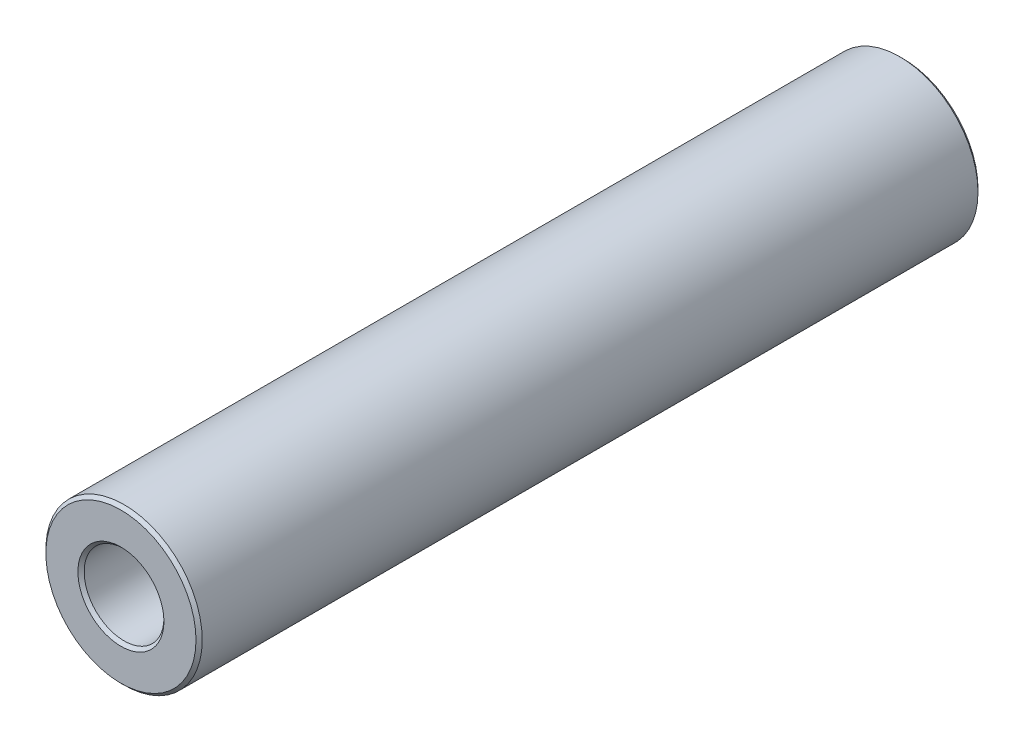
from build123d import *

# Parameters (mm, degrees)
SKETCH1_R           = 5
SKETCH1_R_2         = 2.55
BOSS_EXTRUDE1_DEPTH = 50
CHAMFER1_SIZE       = 0.2


with BuildPart() as part:
    # Sketch1 → Boss-Extrude1 (new body)
    with BuildSketch(Plane.XY):
        Circle(SKETCH1_R)
        Circle(SKETCH1_R_2, mode=Mode.SUBTRACT)
    extrude(amount=BOSS_EXTRUDE1_DEPTH)

    # Chamfer1
    chamfer1_edges = [part.edges().sort_by_distance(p)[0] for p in [
        (-5, 0, 0),
        (-5, 0, 50),
        (-2.55, 0, 0),
        (-2.55, 0, 50),
    ]]
    chamfer(chamfer1_edges, length=CHAMFER1_SIZE)


solid = part.part
